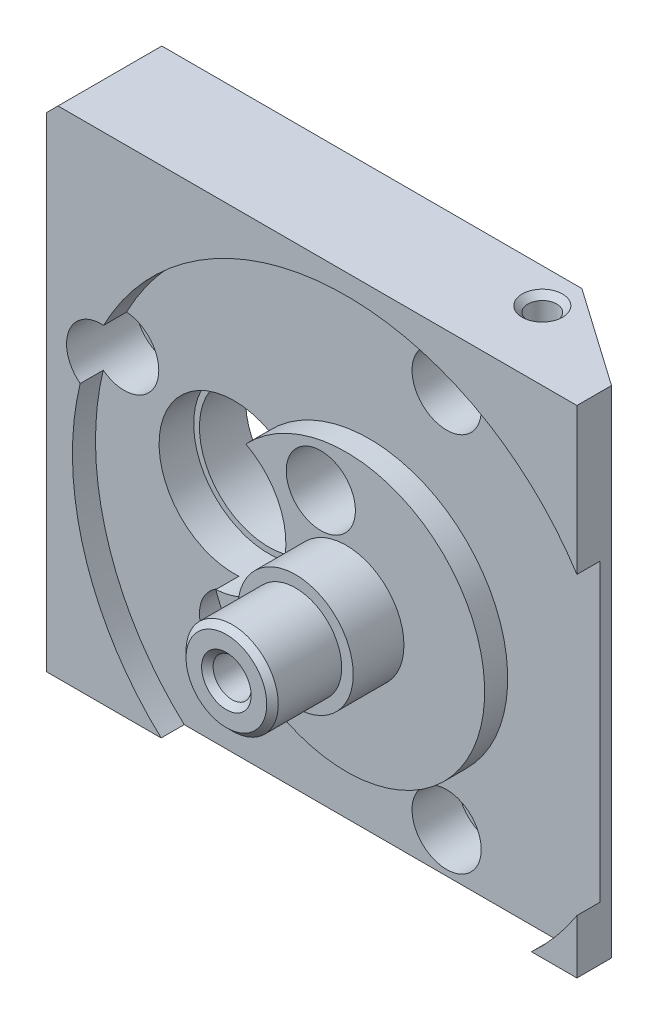
from build123d import *

# Parameters (mm, degrees)
SKETCH_1_W                = 52
SKETCH_1_H                = 45
EXTRUDE_1_DEPTH           = 9
SKETCH_19_R               = 23.75
SKETCH_19_R_2             = 12
CUT_EXTRUDE_2_DEPTH       = 2
SKETCH_20_R               = 5
EXTRUDE_3_DEPTH           = 4.4
SKETCH_21_R               = 4
EXTRUDE_4_DEPTH           = 6
SKETCH_22_R               = 6
CUT_EXTRUDE_5_DEPTH       = 36.922277211
HOLE_WIZARD_1_D           = 3.4
HOLE_WIZARD_1_CBORE_D     = 6
HOLE_WIZARD_1_CBORE_DEPTH = 6
CUT_EXTRUDE_6_DEPTH       = 45
HOLE_WIZARD_M3_1_D        = 2.5
HOLE_WIZARD_M3_1_DEPTH    = 9.5
HOLE_WIZARD_M3_1_TIP      = 0.751075774
HOLE_WIZARD_M4_2_D        = 3.3
HOLE_WIZARD_M4_2_DEPTH    = 10.1
HOLE_WIZARD_M4_2_TIP      = 0.991420021
CHAMFER_3_SIZE            = 0.5
HOLE_WIZARD_M3_4_D        = 2.5
HOLE_WIZARD_M3_4_DEPTH    = 11.5
HOLE_WIZARD_M3_4_TIP      = 0.751075774
CHAMFER_4_SIZE            = 0.5
CHAMFER_5_SIZE            = 1
HOLE_WIZARD_2_D           = 3.4
HOLE_WIZARD_2_CBORE_D     = 6
HOLE_WIZARD_2_CBORE_DEPTH = 6
EXTRUDE1_DEPTH            = 6
EXTRUDE1_DEPTH_BACK       = 3
SKETCH1_R                 = 6.5
EXTRUDE3_DEPTH            = 2
CHAMFER2_SIZE             = 0.5
EXTRUDE4_REACH            = 55.864
SKETCH_34_R               = 1
CUT_EXTRUDE_1_DEPTH       = 4


with BuildPart() as part:
    # 草图1 → 拉伸1 (new body)
    with BuildSketch(Plane.XY):
        Rectangle(SKETCH_1_W, SKETCH_1_H)
    extrude(amount=EXTRUDE_1_DEPTH)

    # 草图19 → 拉伸2 (cut)
    with BuildSketch(Plane.XY.offset(9)):
        with Locations((0, -3)):
            Circle(SKETCH_19_R)
        with Locations((0, -3)):
            Circle(SKETCH_19_R_2, mode=Mode.SUBTRACT)
    extrude(amount=-CUT_EXTRUDE_2_DEPTH, mode=Mode.SUBTRACT)

    # 草图20 → 拉伸3 (add)
    with BuildSketch(Plane.XY.offset(9)):
        with Locations((0, -3)):
            Circle(SKETCH_20_R)
    extrude(amount=EXTRUDE_3_DEPTH)

    # 草图21 → 拉伸4 (add)
    with BuildSketch(Plane.XY.offset(13.4)):
        with Locations((0, -3)):
            Circle(SKETCH_21_R)
    extrude(amount=EXTRUDE_4_DEPTH)

    # 草图22 → 拉伸5 (cut, through all)
    with BuildSketch(Plane.XY.offset(9)):
        with Locations((-11.736694594, -0.5)):
            Circle(SKETCH_22_R)
    extrude(amount=-CUT_EXTRUDE_5_DEPTH, mode=Mode.SUBTRACT)

    # 打孔尺寸根据内六角圆柱头螺钉的类型1 (through all)
    with Locations(Plane(origin=(-21.262974036, 5, 9), x_dir=(1, 0, 0), z_dir=(0, 0, 1))):
        with Locations((0, 0), (9.526279442, -16.5), (19.052558883, 0)):
            CounterBoreHole(HOLE_WIZARD_1_D / 2, HOLE_WIZARD_1_CBORE_D / 2, HOLE_WIZARD_1_CBORE_DEPTH)

    # 草图25 → 拉伸6 (cut)
    with BuildSketch(Plane.XZ.offset(22.5)):
        Polygon((26, 8), (14.574815946, 0), (26, 0), align=None)
    extrude(amount=-CUT_EXTRUDE_6_DEPTH, mode=Mode.SUBTRACT)

    # M3 螺纹孔1
    with Locations(Plane(origin=(11, 22.5, 3), x_dir=(0, 0, 1), z_dir=(0, 1, 0))):
        with Locations((0, 0)):
            Hole(HOLE_WIZARD_M3_1_D / 2, depth=HOLE_WIZARD_M3_1_DEPTH)
            with Locations((0, 0, -(HOLE_WIZARD_M3_1_DEPTH + HOLE_WIZARD_M3_1_TIP / 2))):  # 118° drill point
                Cone(0, HOLE_WIZARD_M3_1_D / 2, HOLE_WIZARD_M3_1_TIP, mode=Mode.SUBTRACT)

    # M4 螺纹孔2
    with Locations(Plane(origin=(0, -3, 19.4), x_dir=(1, 0, 0), z_dir=(0, 0, 1))):
        with Locations((0, 0)):
            Hole(HOLE_WIZARD_M4_2_D / 2, depth=HOLE_WIZARD_M4_2_DEPTH)
            with Locations((0, 0, -(HOLE_WIZARD_M4_2_DEPTH + HOLE_WIZARD_M4_2_TIP / 2))):  # 118° drill point
                Cone(0, HOLE_WIZARD_M4_2_D / 2, HOLE_WIZARD_M4_2_TIP, mode=Mode.SUBTRACT)

    # 倒角3
    chamfer_3_edges = [part.edges().sort_by_distance(p)[0] for p in [
        (-4, -3, 19.4),
        (1.65, -3, 19.4),
    ]]
    chamfer(chamfer_3_edges, length=CHAMFER_3_SIZE)

    # M3 螺纹孔4
    with Locations(Plane(origin=(11, -22.5, 3), x_dir=(0, 0, -1), z_dir=(0, -1, 0))):
        with Locations((0, 0), (0, -35)):
            Hole(HOLE_WIZARD_M3_4_D / 2, depth=HOLE_WIZARD_M3_4_DEPTH)
            with Locations((0, 0, -(HOLE_WIZARD_M3_4_DEPTH + HOLE_WIZARD_M3_4_TIP / 2))):  # 118° drill point
                Cone(0, HOLE_WIZARD_M3_4_D / 2, HOLE_WIZARD_M3_4_TIP, mode=Mode.SUBTRACT)

    # 倒角4
    chamfer_4_edges = [part.edges().sort_by_distance(p)[0] for p in [
        (-24, -22.5, 1.75),
        (11, -22.5, 1.75),
        (11, 22.5, 4.25),
    ]]
    chamfer(chamfer_4_edges, length=CHAMFER_4_SIZE)

    # 倒角5
    chamfer_5_edges = [part.edges().sort_by_distance(p)[0] for p in [
        (-26, 22.5, 4.5),
    ]]
    chamfer(chamfer_5_edges, length=CHAMFER_5_SIZE)

    # 打孔尺寸根据内六角圆柱头螺钉的类型2 (through all)
    with Locations(Plane(origin=(6.7, 16, 9), x_dir=(1, 0, 0), z_dir=(0, 0, 1))):
        with Locations((0, 0), (0, -33)):
            CounterBoreHole(HOLE_WIZARD_2_D / 2, HOLE_WIZARD_2_CBORE_D / 2, HOLE_WIZARD_2_CBORE_DEPTH)

    # Sketch1 → Extrude1 (cut, two sides: drawn at the far end of the back side and taken through both)
    with BuildSketch(Plane.XY.offset(7).offset(-EXTRUDE1_DEPTH_BACK)):
        with Locations(Location((-11.736694594, -0.5, 0), (0, 0, 273.689161867))):
            Circle(SKETCH1_R)
    extrude(amount=EXTRUDE1_DEPTH + EXTRUDE1_DEPTH_BACK, mode=Mode.SUBTRACT)

    # Sketch4 → Extrude3 (cut)
    with BuildSketch(Plane.XZ.offset(22.5)):
        Polygon((-26, 0), (14.574815946, 0), (26, 8), (26, 9), (13.557746863, 9), (13.557746863, 7), (-13.557746863, 7), (-13.557746863, 9), (-26, 9), align=None)
    extrude(amount=-EXTRUDE3_DEPTH, mode=Mode.SUBTRACT)

    # Chamfer2
    chamfer2_edges = [part.edges().sort_by_distance(p)[0] for p in [
        (-24, -20.5, 1.75),
        (11, -20.5, 1.75),
    ]]
    chamfer(chamfer2_edges, length=CHAMFER2_SIZE)

    # Extrude4: up to this face of the body (flat: up to its plane)
    extrude4_end = Plane(part.part.faces().sort_by_distance((-2.205978038, 22.5, 4.743303676))[0])
    # Sketch5 → Extrude4 (cut, up to the picked face)
    with BuildSketch(Plane.XZ.offset(20.5), mode=Mode.PRIVATE) as extrude4_sk1:
        Polygon((26, 9), (20, 9), (20, 6), (11.43111196, 0), (14.574815946, 0), (26, 8), align=None)
    extrude4_tool1 = split(extrude(extrude4_sk1.sketch, amount=-EXTRUDE4_REACH, mode=Mode.PRIVATE), bisect_by=extrude4_end, keep=Keep.BOTH, mode=Mode.PRIVATE)
    add(extrude4_tool1.solids().sort_by(Axis((19.659359, -20.5, 5.073959), (0, 1, 0)))[0], mode=Mode.SUBTRACT)

    # 草图34 → 切除-拉伸1 (cut)
    with BuildSketch(Plane.XZ.offset(20.5)):
        with Locations(Location((1, 3, 0), (0, 0, 270))):
            Circle(SKETCH_34_R)
        with Locations(Location((-14, 3, 0), (0, 0, 270))):
            Circle(SKETCH_34_R)
    extrude(amount=-CUT_EXTRUDE_1_DEPTH, mode=Mode.SUBTRACT)


solid = part.part
